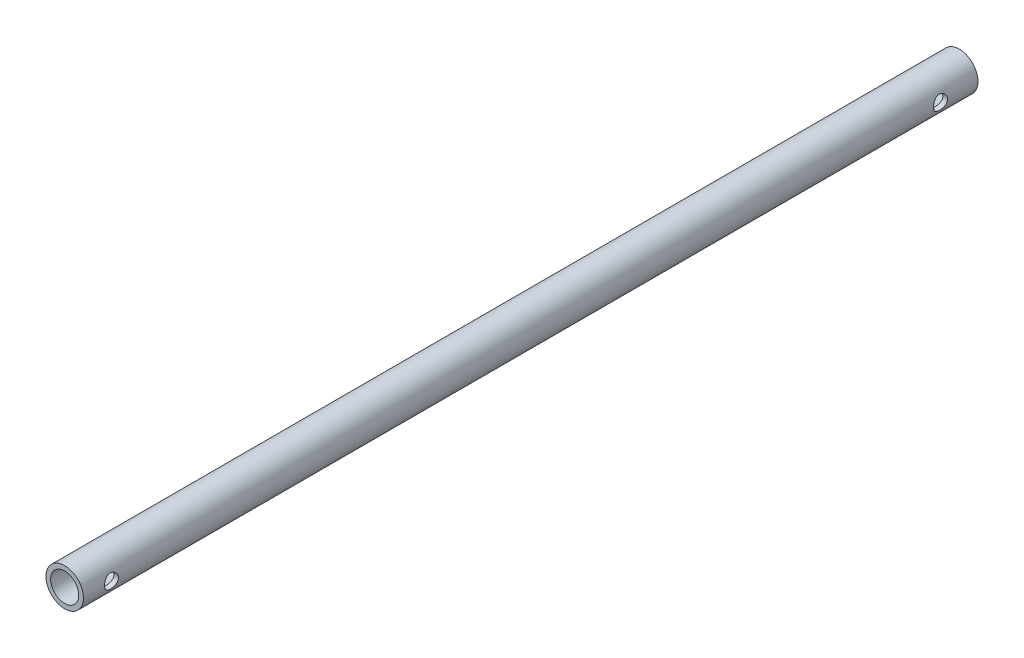
from build123d import *

# Parameters (mm, degrees)
SKETCH1_R               = 4
SKETCH1_R_2             = 3
BOSS_EXTRUDE1_DEPTH     = 191
CUT_EXTRUDE1_DEPTH      = 192.209309397
CUT_EXTRUDE1_DEPTH_BACK = 192.209309397
SKETCH3_R               = 1.5


with BuildPart() as part:
    # Sketch1 → Boss-Extrude1 (new body)
    with BuildSketch(Plane.XY):
        Circle(SKETCH1_R)
        Circle(SKETCH1_R_2, mode=Mode.SUBTRACT)
    extrude(amount=BOSS_EXTRUDE1_DEPTH)

    # Sketch3 → Cut-Extrude1 (cut, two sides: drawn at the far end of the back side and taken through both)
    with BuildSketch(Plane(origin=(4, 0, 0), x_dir=(0, 0, -1), z_dir=(1, 0, 0)).offset(-CUT_EXTRUDE1_DEPTH_BACK)):
        with Locations((-185, 0)):
            Circle(SKETCH3_R)
        with Locations((-8, 0)):
            Circle(SKETCH3_R)
    extrude(amount=CUT_EXTRUDE1_DEPTH + CUT_EXTRUDE1_DEPTH_BACK, mode=Mode.SUBTRACT)


solid = part.part
